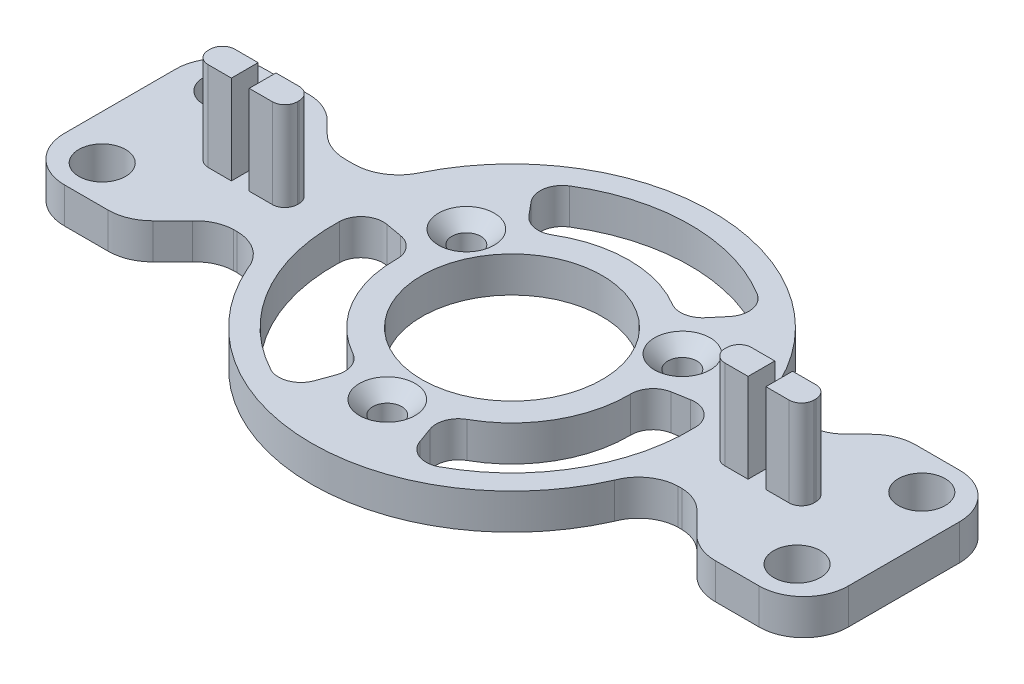
from build123d import *

# Parameters (mm, degrees)
SKETCH1_R           = 10.125
SKETCH1_R_2         = 1.625
SKETCH1_R_3         = 2.625
BOSS_EXTRUDE1_DEPTH = 4
BOSS_EXTRUDE2_DEPTH = 10
CHAMFER1_SIZE       = 1.5


with BuildPart() as part:
    # Sketch1 → Boss-Extrude1 (new body)
    with BuildSketch(Plane(origin=(0, 0, 0), x_dir=(1, 0, 0), z_dir=(0, 1, 0))):
        with BuildLine():
            Line((-34.071067812, 11.251987552), (-39, 11.251987552))
            ThreePointArc((-39, 11.251987552), (-42.535533906, 9.787521458), (-44, 6.251987552))
            Line((-44, 6.251987552), (-44, -6.251987552))
            ThreePointArc((-44, -6.251987552), (-42.535533906, -9.787521458), (-39, -11.251987552))
            Line((-39, -11.251987552), (-34.071067812, -11.251987552))
            ThreePointArc((-34.071067812, -11.251987552), (-32.15765065, -10.871385214), (-30.535533906, -9.787521458))
            Line((-30.535533906, -9.787521458), (-28.313936139, -7.565923691))
            ThreePointArc((-28.313936139, -7.565923691), (-26.887697685, -6.508651832), (-25.159643066, -6.101457597))
            Line((-25.159643066, -6.101457597), (-24.760034307, -6.101457597))
            ThreePointArc((-24.760034307, -6.101457597), (-22.194921551, -6.923374854), (-20.585162509, -9.083010761))
            ThreePointArc((-20.585162509, -9.083010761), (-20.064123568, -10.182384075), (-19.484423936, -11.251987552))
            ThreePointArc((-19.484423936, -11.251987552), (1.21615025, -22.467108816), (20.585162509, -9.083010761))
            ThreePointArc((20.585162509, -9.083010761), (22.216290811, -6.953296816), (24.760034307, -6.101457597))
            Line((24.760034307, -6.101457597), (25.159643066, -6.101457597))
            ThreePointArc((25.159643066, -6.101457597), (26.890244586, -6.503166098), (28.313936139, -7.565923691))
            Line((28.313936139, -7.565923691), (30.535533906, -9.787521458))
            ThreePointArc((30.535533906, -9.787521458), (32.15765065, -10.871385214), (34.071067812, -11.251987552))
            Line((34.071067812, -11.251987552), (39, -11.251987552))
            ThreePointArc((39, -11.251987552), (42.535533906, -9.787521458), (44, -6.251987552))
            Line((44, -6.251987552), (44, 6.251987552))
            ThreePointArc((44, 6.251987552), (42.535533906, 9.787521458), (39, 11.251987552))
            Line((39, 11.251987552), (34.071067812, 11.251987552))
            ThreePointArc((34.071067812, 11.251987552), (32.15765065, 10.871385214), (30.535533906, 9.787521458))
            Line((30.535533906, 9.787521458), (29.212478542, 8.464466094))
            ThreePointArc((29.212478542, 8.464466094), (27.590361798, 7.380602337), (25.676944636, 7))
            Line((25.676944636, 7), (24.743686063, 7))
            ThreePointArc((24.743686063, 7), (22.08935855, 7.762719569), (20.244834052, 9.818181818))
            ThreePointArc((20.244834052, 9.818181818), (0.811483584, 22.48536178), (-19.484423936, 11.251987552))
            ThreePointArc((-19.484423936, 11.251987552), (-19.877561088, 10.541943142), (-20.244834052, 9.818181818))
            ThreePointArc((-20.244834052, 9.818181818), (-22.08935855, 7.762719569), (-24.743686063, 7))
            Line((-24.743686063, 7), (-25.676944636, 7))
            ThreePointArc((-25.676944636, 7), (-27.590361798, 7.380602337), (-29.212478542, 8.464466094))
            Line((-29.212478542, 8.464466094), (-30.535533906, 9.787521458))
            ThreePointArc((-30.535533906, 9.787521458), (-32.15765065, 10.871385214), (-34.071067812, 11.251987552))
        make_face()
        with Locations(Location((0, 0, 0), (0, 0, 270))):
            Circle(SKETCH1_R, mode=Mode.SUBTRACT)
        with Locations(Location((-12.124355653, 7, 0), (0, 0, 270))):
            Circle(SKETCH1_R_2, mode=Mode.SUBTRACT)
        with Locations(Location((12.124355653, 7, 0), (0, 0, 270))):
            Circle(SKETCH1_R_2, mode=Mode.SUBTRACT)
        with Locations(Location((0, -14, 0), (0, 0, 270))):
            Circle(SKETCH1_R_2, mode=Mode.SUBTRACT)
        with Locations(Location((-39, 7, 0), (0, 0, 270))):
            Circle(SKETCH1_R_3, mode=Mode.SUBTRACT)
        with Locations(Location((-39, -7, 0), (0, 0, 270))):
            Circle(SKETCH1_R_3, mode=Mode.SUBTRACT)
        with Locations(Location((39, -7, 0), (0, 0, 90))):
            Circle(SKETCH1_R_3, mode=Mode.SUBTRACT)
        with Locations(Location((39, 7, 0), (0, 0, 90))):
            Circle(SKETCH1_R_3, mode=Mode.SUBTRACT)
        with BuildLine():
            Line((-5.27521723, -14.493540222), (-5.923962655, -16.275953627))
            ThreePointArc((-5.923962655, -16.275953627), (-7.381618464, -17.756517255), (-9.455079093, -17.62388945))
            ThreePointArc((-9.455079093, -17.62388945), (-17.320508076, -10), (-19.990275524, 0.623606036))
            ThreePointArc((-19.990275524, 0.623606036), (-19.068404258, 2.485589517), (-17.057370639, 3.007674664))
            Line((-17.057370639, 3.007674664), (-15.189382638, 2.678297979))
            ThreePointArc((-15.189382638, 2.678297979), (-13.697315881, 1.809954494), (-13.123742589, 0.181674021))
            ThreePointArc((-13.123742589, 0.181674021), (-11.366583425, -6.5625), (-6.404536977, -11.456331486))
            ThreePointArc((-6.404536977, -11.456331486), (-5.281191369, -12.767200763), (-5.27521723, -14.493540222))
        make_face(mode=Mode.SUBTRACT)
        with BuildLine():
            Line((-9.914165408, 11.815242243), (-11.133407985, 13.268278963))
            ThreePointArc((-11.133407985, 13.268278963), (-11.686785794, 15.270927738), (-10.535196431, 17.000283414))
            ThreePointArc((-10.535196431, 17.000283414), (0, 20), (10.535196431, 17.000283414))
            ThreePointArc((10.535196431, 17.000283414), (11.686785794, 15.270927738), (11.133407985, 13.268278963))
            Line((11.133407985, 13.268278963), (9.914165408, 11.815242243))
            ThreePointArc((9.914165408, 11.815242243), (8.416124512, 10.95724627), (6.719205612, 11.274657464))
            ThreePointArc((6.719205612, 11.274657464), (0, 13.125), (-6.719205612, 11.274657464))
            ThreePointArc((-6.719205612, 11.274657464), (-8.416124512, 10.95724627), (-9.914165408, 11.815242243))
        make_face(mode=Mode.SUBTRACT)
        with BuildLine():
            Line((15.189382638, 2.678297979), (17.057370639, 3.007674664))
            ThreePointArc((17.057370639, 3.007674664), (19.068404258, 2.485589517), (19.990275524, 0.623606036))
            ThreePointArc((19.990275524, 0.623606036), (17.320508076, -10), (9.455079093, -17.62388945))
            ThreePointArc((9.455079093, -17.62388945), (7.381618464, -17.756517255), (5.923962655, -16.275953627))
            Line((5.923962655, -16.275953627), (5.27521723, -14.493540222))
            ThreePointArc((5.27521723, -14.493540222), (5.281191369, -12.767200763), (6.404536977, -11.456331486))
            ThreePointArc((6.404536977, -11.456331486), (11.366583425, -6.5625), (13.123742589, 0.181674021))
            ThreePointArc((13.123742589, 0.181674021), (13.697315881, 1.809954494), (15.189382638, 2.678297979))
        make_face(mode=Mode.SUBTRACT)
    extrude(amount=BOSS_EXTRUDE1_DEPTH)

    # Sketch2 → Boss-Extrude2 (add)
    with BuildSketch(Plane(origin=(0, 4, 0), x_dir=(1, 0, 0), z_dir=(0, 1, 0))):
        with BuildLine():
            Line((-32.6, 1.5), (-30, 1.5))
            Line((-30, 1.5), (-30, -1.5))
            Line((-30, -1.5), (-32.6, -1.5))
            ThreePointArc((-32.6, -1.5), (-33.589949494, -1.089949494), (-34, -0.1))
            Line((-34, -0.1), (-34, 0.1))
            ThreePointArc((-34, 0.1), (-33.589949494, 1.089949494), (-32.6, 1.5))
        make_face()
        with BuildLine():
            Line((-28, 1.5), (-25.4, 1.5))
            ThreePointArc((-25.4, 1.5), (-24.410050506, 1.089949494), (-24, 0.1))
            Line((-24, 0.1), (-24, -0.1))
            ThreePointArc((-24, -0.1), (-24.410050506, -1.089949494), (-25.4, -1.5))
            Line((-25.4, -1.5), (-28, -1.5))
            Line((-28, -1.5), (-28, 1.5))
        make_face()
    boss_extrude2 = extrude(amount=BOSS_EXTRUDE2_DEPTH)

    # Mirror1: Boss-Extrude2 across plane
    add(boss_extrude2.mirror(Plane(origin=(0, 0, 0), x_dir=(0, 0, 1), z_dir=(1, 0, 0))))

    # Chamfer1
    chamfer1_edges = [part.edges().sort_by_distance(p)[0] for p in [
        (-12.124355653, 4, -8.625),
        (12.124355653, 4, -8.625),
        (0, 4, 12.375),
    ]]
    chamfer(chamfer1_edges, length=CHAMFER1_SIZE)


solid = part.part
